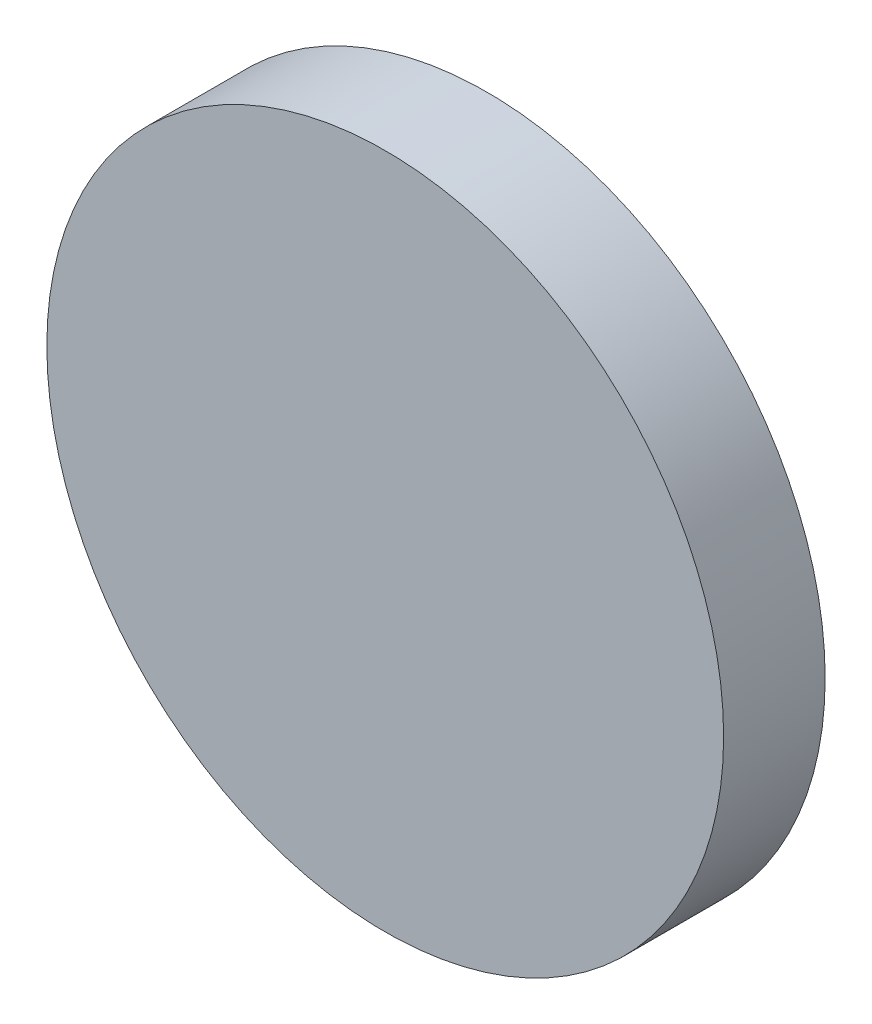
from build123d import *

# Parameters (mm, degrees)
SK_HORN_R  = 10
HORN_DEPTH = 3


with BuildPart() as part:
    # SK_Horn → Horn (new body)
    with BuildSketch(Plane.XY):
        Circle(SK_HORN_R)
    extrude(amount=HORN_DEPTH)


solid = part.part
